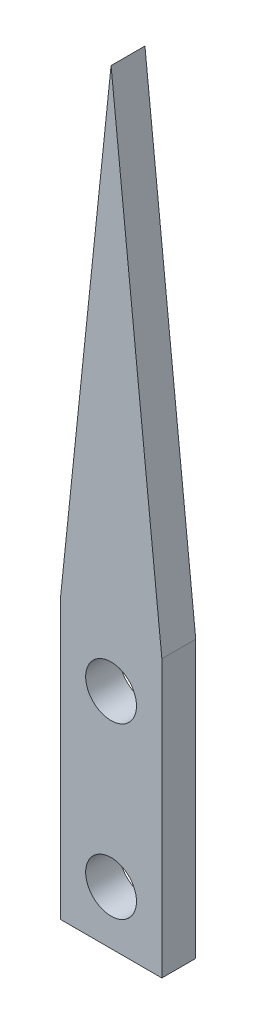
from build123d import *

# Parameters (mm, degrees)
SKETCH_1_R      = 1.5
EXTRUDE_1_DEPTH = 2


with BuildPart() as part:
    # 草图1 → 凸台-拉伸1 (new body)
    with BuildSketch(Plane.XY):
        Polygon((3, 3.164176285), (0, 32), (-3, 3.164176285), (-3, -13.164176285), (3, -13.164176285), align=None)
        Circle(SKETCH_1_R, mode=Mode.SUBTRACT)
        with Locations((0, -10)):
            Circle(SKETCH_1_R, mode=Mode.SUBTRACT)
    extrude(amount=EXTRUDE_1_DEPTH)


solid = part.part
